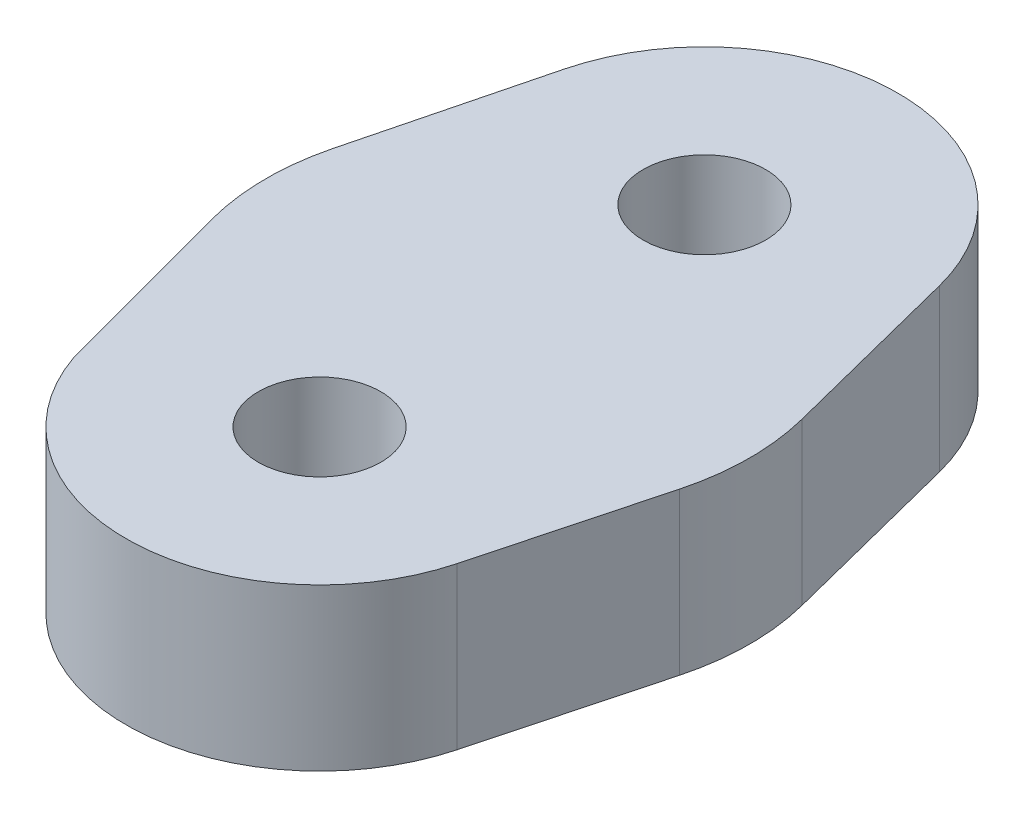
from build123d import *

# Parameters (mm, degrees)
BOSS_EXTRUDE2_DEPTH   = 5
F_6_CLEARANCE_HOLE1_D = 3.7973


with BuildPart() as part:
    # Sketch2 → Boss-Extrude2 (new body)
    with BuildSketch(Plane(origin=(0, 0, 0), x_dir=(1, 0, 0), z_dir=(0, 1, 0))):
        with BuildLine():
            ThreePointArc((-1.921673483, -7.798539123), (3.967844549, -11.837003018), (9.548776015, -7.381801872))
            Line((9.548776015, -7.381801872), (10.998470019, -1.926053578))
            ThreePointArc((10.998470019, -1.926053578), (11.24988985, -0.04064778), (11.018921171, 1.84737246))
            Line((11.018921171, 1.84737246), (9.565136937, 7.567628243))
            ThreePointArc((9.565136937, 7.567628243), (3.75, 12.089730275), (-2.065136937, 7.567628243))
            Line((-2.065136937, 7.567628243), (-3.518921171, 1.84737246))
            ThreePointArc((-3.518921171, 1.84737246), (-3.749830525, -0.050419155), (-3.493426606, -1.944934706))
            Line((-3.493426606, -1.944934706), (-1.921673483, -7.798539123))
        make_face()
    extrude(amount=BOSS_EXTRUDE2_DEPTH)

    # #6 Clearance Hole1 (through all)
    with Locations(Plane(origin=(0, 5, 0), x_dir=(1, 0, 0), z_dir=(0, 1, 0))):
        with Locations((3.75, 6.089730275), (3.75, -5.840959009)):
            Hole(F_6_CLEARANCE_HOLE1_D / 2)


solid = part.part
